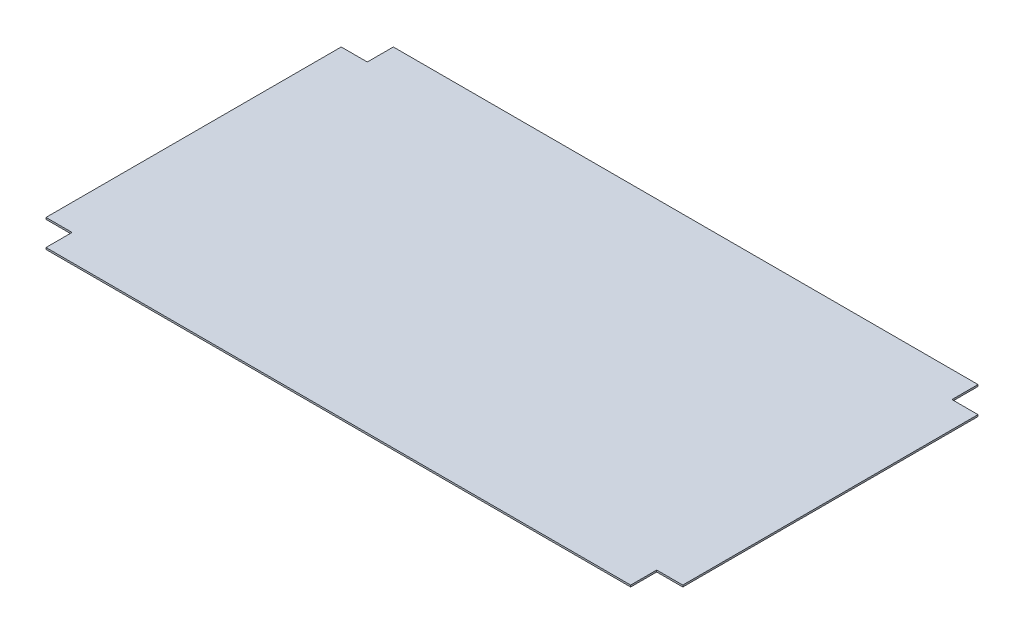
from build123d import *

# Parameters (mm, degrees)
CROQUIS1_W     = 1100
CROQUIS1_H     = 600
EXTRUIR1_DEPTH = 3
CROQUIS2_W     = 45
CROQUIS2_H     = 45
EXTRUIR2_DEPTH = 3


with BuildPart() as part:
    # Croquis1 → Extruir1 (new body)
    with BuildSketch(Plane(origin=(0, 0, 0), x_dir=(1, 0, 0), z_dir=(0, 1, 0))):
        Rectangle(CROQUIS1_W, CROQUIS1_H)
    extrude(amount=EXTRUIR1_DEPTH)

    # Croquis2 → Extruir2 (cut)
    with BuildSketch(Plane(origin=(0, 3, 0), x_dir=(1, 0, 0), z_dir=(0, 1, 0))):
        with Locations((-527.5, 277.5)):
            Rectangle(CROQUIS2_W, CROQUIS2_H)
        with Locations((527.5, 277.5)):
            Rectangle(CROQUIS2_W, CROQUIS2_H)
        with Locations((-527.5, -277.5)):
            Rectangle(CROQUIS2_W, CROQUIS2_H)
        with Locations((527.5, -277.5)):
            Rectangle(CROQUIS2_W, CROQUIS2_H)
    extrude(amount=-EXTRUIR2_DEPTH, mode=Mode.SUBTRACT)


solid = part.part
